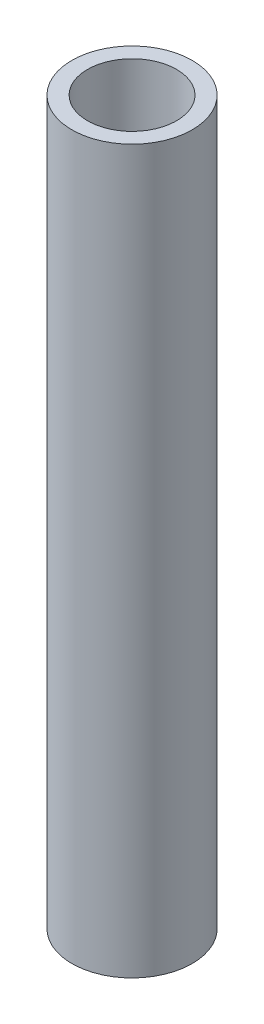
from build123d import *

# Parameters (mm, degrees)
SKETCH1_R           = 6.35
SKETCH1_R_2         = 4.699
BOSS_EXTRUDE1_DEPTH = 76.2


with BuildPart() as part:
    # Sketch1 → Boss-Extrude1 (new body)
    with BuildSketch(Plane(origin=(0, 0, 0), x_dir=(1, 0, 0), z_dir=(0, 1, 0))):
        with Locations(Location((0, 0, 0), (0, 0, 90))):
            Circle(SKETCH1_R)
        with Locations(Location((0, 0, 0), (0, 0, 90))):
            Circle(SKETCH1_R_2, mode=Mode.SUBTRACT)
    extrude(amount=BOSS_EXTRUDE1_DEPTH)


solid = part.part
